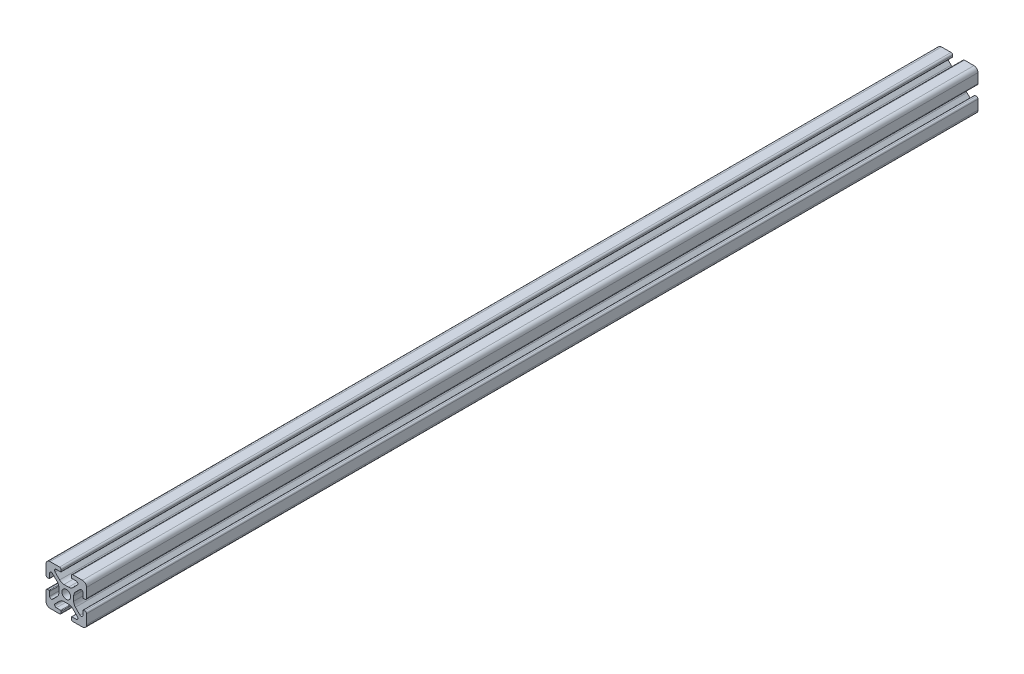
from build123d import *

# Parameters (mm, degrees)
BOSS_EXTRU_1_DEPTH = 440


with BuildPart() as part:
    # Esquisse1 → Boss.-Extru.1 (new body)
    with BuildSketch(Plane.XY):
        with BuildLine():
            Line((-3.255887446, 4.528679645), (-5.506192286, 6.778984485))
            ThreePointArc((-5.506192286, 6.778984485), (-5.686636441, 7.686138511), (-4.917588391, 8.199999989))
            Line((-4.917588391, 8.199999989), (-2.799999991, 8.199999989))
            ThreePointArc((-2.799999991, 8.199999989), (-2.587867957, 8.287867955), (-2.499999991, 8.499999989))
            Line((-2.499999991, 8.499999989), (-2.499999991, 9.199999989))
            ThreePointArc((-2.499999991, 9.199999989), (-2.734314566, 9.765685414), (-3.299999991, 9.999999989))
            Line((-3.299999991, 9.999999989), (-7.999999991, 9.999999989))
            ThreePointArc((-7.999999991, 9.999999989), (-9.414213554, 9.414213552), (-9.999999991, 7.999999989))
            Line((-9.999999991, 7.999999989), (-9.999999991, 3.299999989))
            ThreePointArc((-9.999999991, 3.299999989), (-9.765685416, 2.734314564), (-9.199999991, 2.499999989))
            Line((-9.199999991, 2.499999989), (-8.499999991, 2.499999989))
            ThreePointArc((-8.499999991, 2.499999989), (-8.287867957, 2.587867955), (-8.199999991, 2.799999989))
            Line((-8.199999991, 2.799999989), (-8.199999991, 4.917588389))
            ThreePointArc((-8.199999991, 4.917588389), (-7.686138517, 5.686636433), (-6.778984497, 5.506192279))
            Line((-6.778984497, 5.506192279), (-4.528679657, 3.255887439))
            ThreePointArc((-4.528679657, 3.255887439), (-3.878361403, 2.282617393), (-3.650000001, 1.134567096))
            Line((-3.650000001, 1.134567096), (-3.650000001, -1.134567114))
            ThreePointArc((-3.650000001, -1.134567114), (-3.878361403, -2.282617409), (-4.528679656, -3.255887454))
            Line((-4.528679656, -3.255887454), (-6.778984496, -5.506192294))
            ThreePointArc((-6.778984496, -5.506192294), (-7.686138522, -5.686636449), (-8.2, -4.9175884))
            Line((-8.2, -4.9175884), (-8.2, -2.8))
            ThreePointArc((-8.2, -2.8), (-8.287867966, -2.587867966), (-8.5, -2.5))
            Line((-8.5, -2.5), (-9.2, -2.5))
            ThreePointArc((-9.2, -2.5), (-9.765685425, -2.734314575), (-10, -3.3))
            Line((-10, -3.3), (-10, -8))
            ThreePointArc((-10, -8), (-9.414213562, -9.414213562), (-8, -10))
            Line((-8, -10), (-3.3, -10))
            ThreePointArc((-3.3, -10), (-2.734314575, -9.765685425), (-2.5, -9.2))
            Line((-2.5, -9.2), (-2.5, -8.5))
            ThreePointArc((-2.5, -8.5), (-2.587867966, -8.287867966), (-2.8, -8.2))
            Line((-2.8, -8.2), (-4.9175884, -8.2))
            ThreePointArc((-4.9175884, -8.2), (-5.686636444, -7.686138526), (-5.50619229, -6.778984506))
            Line((-5.50619229, -6.778984506), (-3.25588745, -4.528679666))
            ThreePointArc((-3.25588745, -4.528679666), (-2.282617404, -3.878361412), (-1.134567106, -3.650000009))
            Line((-1.134567106, -3.650000009), (1.134567104, -3.650000009))
            ThreePointArc((1.134567104, -3.650000009), (2.282617399, -3.878361412), (3.255887444, -4.528679664))
            Line((3.255887444, -4.528679664), (5.506192284, -6.778984504))
            ThreePointArc((5.506192284, -6.778984504), (5.686636439, -7.686138531), (4.917588389, -8.200000009))
            Line((4.917588389, -8.200000009), (2.799999989, -8.200000009))
            ThreePointArc((2.799999989, -8.200000009), (2.587867955, -8.287867974), (2.499999989, -8.500000009))
            Line((2.499999989, -8.500000009), (2.499999989, -9.200000009))
            ThreePointArc((2.499999989, -9.200000009), (2.734314564, -9.765685434), (3.299999989, -10.000000009))
            Line((3.299999989, -10.000000009), (7.999999989, -10.000000009))
            ThreePointArc((7.999999989, -10.000000009), (9.414213552, -9.414213571), (9.999999989, -8.000000009))
            Line((9.999999989, -8.000000009), (9.999999989, -3.300000009))
            ThreePointArc((9.999999989, -3.300000009), (9.765685414, -2.734314584), (9.199999989, -2.500000009))
            Line((9.199999989, -2.500000009), (8.499999989, -2.500000009))
            ThreePointArc((8.499999989, -2.500000009), (8.287867955, -2.587867974), (8.199999989, -2.800000009))
            Line((8.199999989, -2.800000009), (8.199999989, -4.917588409))
            ThreePointArc((8.199999989, -4.917588409), (7.686138515, -5.686636452), (6.778984495, -5.506192299))
            Line((6.778984495, -5.506192299), (4.528679655, -3.255887459))
            ThreePointArc((4.528679655, -3.255887459), (3.878361401, -2.282617412), (3.649999999, -1.134567115))
            Line((3.649999999, -1.134567115), (3.649999999, 1.134567095))
            ThreePointArc((3.649999999, 1.134567095), (3.878361401, 2.28261739), (4.528679654, 3.255887435))
            Line((4.528679654, 3.255887435), (6.778984494, 5.506192275))
            ThreePointArc((6.778984494, 5.506192275), (7.68613852, 5.68663643), (8.199999998, 4.917588381))
            Line((8.199999998, 4.917588381), (8.199999998, 2.799999981))
            ThreePointArc((8.199999998, 2.799999981), (8.287867964, 2.587867946), (8.499999998, 2.499999981))
            Line((8.499999998, 2.499999981), (9.199999998, 2.499999981))
            ThreePointArc((9.199999998, 2.499999981), (9.765685423, 2.734314556), (9.999999998, 3.299999981))
            Line((9.999999998, 3.299999981), (9.999999998, 7.999999981))
            ThreePointArc((9.999999998, 7.999999981), (9.41421356, 9.414213543), (7.999999998, 9.999999981))
            Line((7.999999998, 9.999999981), (3.299999998, 9.999999981))
            ThreePointArc((3.299999998, 9.999999981), (2.734314573, 9.765685406), (2.499999998, 9.199999981))
            Line((2.499999998, 9.199999981), (2.499999998, 8.499999981))
            ThreePointArc((2.499999998, 8.499999981), (2.587867964, 8.287867946), (2.799999998, 8.199999981))
            Line((2.799999998, 8.199999981), (4.917588398, 8.199999981))
            ThreePointArc((4.917588398, 8.199999981), (5.686636442, 7.686138507), (5.506192288, 6.778984487))
            Line((5.506192288, 6.778984487), (3.255887448, 4.528679647))
            ThreePointArc((3.255887448, 4.528679647), (2.282617402, 3.878361393), (1.134567104, 3.64999999))
            Line((1.134567104, 3.64999999), (-1.134567106, 3.64999999))
            ThreePointArc((-1.134567106, 3.64999999), (-2.282617401, 3.878361392), (-3.255887446, 4.528679645))
        make_face()
        with BuildLine():
            ThreePointArc((-2.15, 0), (0, -2.15), (2.15, 0))
            ThreePointArc((2.15, 0), (0, 2.15), (-2.15, 0))
        make_face(mode=Mode.SUBTRACT)
    extrude(amount=BOSS_EXTRU_1_DEPTH)


solid = part.part
